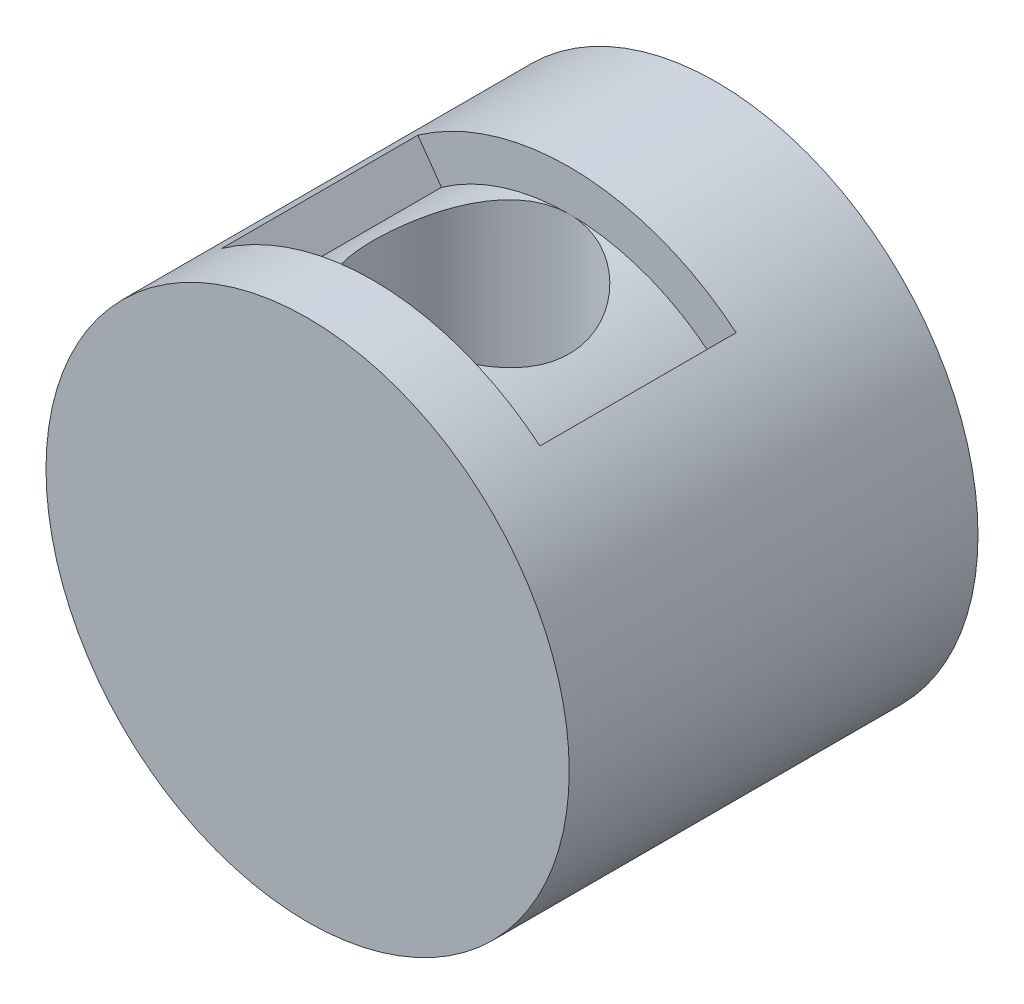
from build123d import *

# Parameters (mm, degrees)
SKETCH1_R               = 16
BOSS_EXTRUDE1_DEPTH     = 25
CUT_EXTRUDE1_DEPTH      = 34.7194306
CUT_EXTRUDE1_DEPTH_BACK = 34.7194306
SKETCH2_R               = 6
CUT_EXTRUDE2_START      = -4
CUT_EXTRUDE2_DEPTH      = 12


with BuildPart() as part:
    # Sketch1 → Boss-Extrude1 (new body)
    with BuildSketch(Plane.XY):
        Circle(SKETCH1_R)
    extrude(amount=-BOSS_EXTRUDE1_DEPTH)

    # Sketch2 → Cut-Extrude1 (cut, two sides: drawn at the far end of the back side and taken through both)
    with BuildSketch(Plane(origin=(0, 0, 0), x_dir=(1, 0, 0), z_dir=(0, 1, 0)).offset(-CUT_EXTRUDE1_DEPTH_BACK)):
        with Locations(Location((0, 10, 0), (0, 0, 270))):
            Circle(SKETCH2_R)
    extrude(amount=CUT_EXTRUDE1_DEPTH + CUT_EXTRUDE1_DEPTH_BACK, mode=Mode.SUBTRACT)

    # Sketch3 → Cut-Extrude2 (cut)
    with BuildSketch(Plane.XY.offset(CUT_EXTRUDE2_START)):
        with BuildLine():
            Line((-7.81200483, 11.010112649), (-9.258672391, 13.049022398))
            ThreePointArc((-9.258672391, 13.049022398), (0.598342854, 15.988808143), (10.208066995, 12.320526296))
            Line((10.208066995, 12.320526296), (8.613056527, 10.395444063))
            ThreePointArc((8.613056527, 10.395444063), (0.504851783, 13.490556871), (-7.81200483, 11.010112649))
        make_face()
    extrude(amount=-CUT_EXTRUDE2_DEPTH, mode=Mode.SUBTRACT)


solid = part.part
